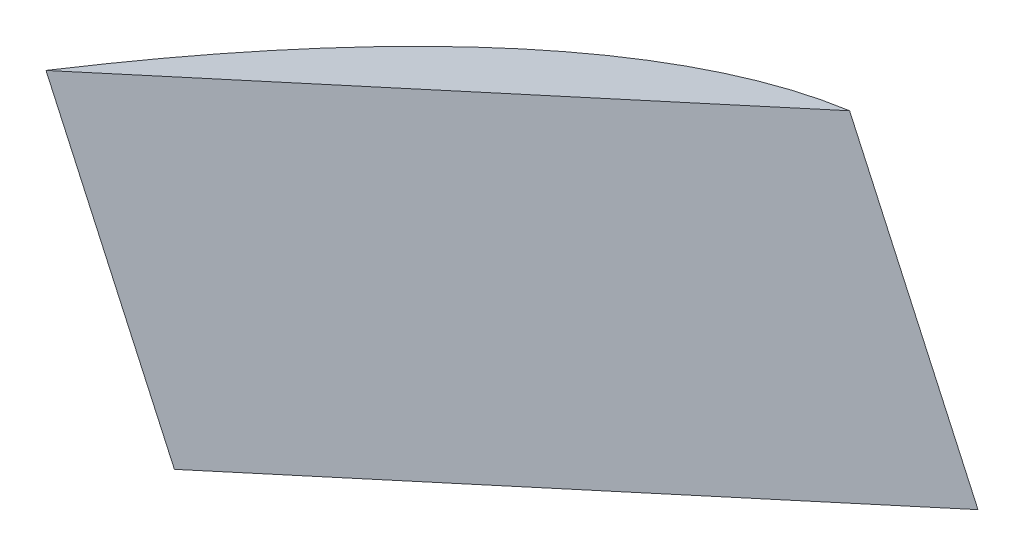
from build123d import *

# Parameters (mm, degrees)
BOSS_EXTRUDE1_DEPTH      = 21
BOSS_EXTRUDE1_DEPTH_BACK = 21


with BuildPart() as part:
    # Sketch2 → Boss-Extrude1 (new, two sides: drawn at the far end of the back side and taken through both)
    with BuildSketch(Plane(origin=(55.775760293, -122.16558985, 0), x_dir=(0, 0, -1), z_dir=(0.41532015702819985, -0.9096753086492299, 0)).offset(-BOSS_EXTRUDE1_DEPTH_BACK)):
        with BuildLine():
            Line((30, 119.143075391), (30, -0.856924609))
            ThreePointArc((30, -0.856924609), (39.826491925, 59.143075391), (30, 119.143075391))
        make_face()
    extrude(amount=BOSS_EXTRUDE1_DEPTH + BOSS_EXTRUDE1_DEPTH_BACK)


solid = part.part
